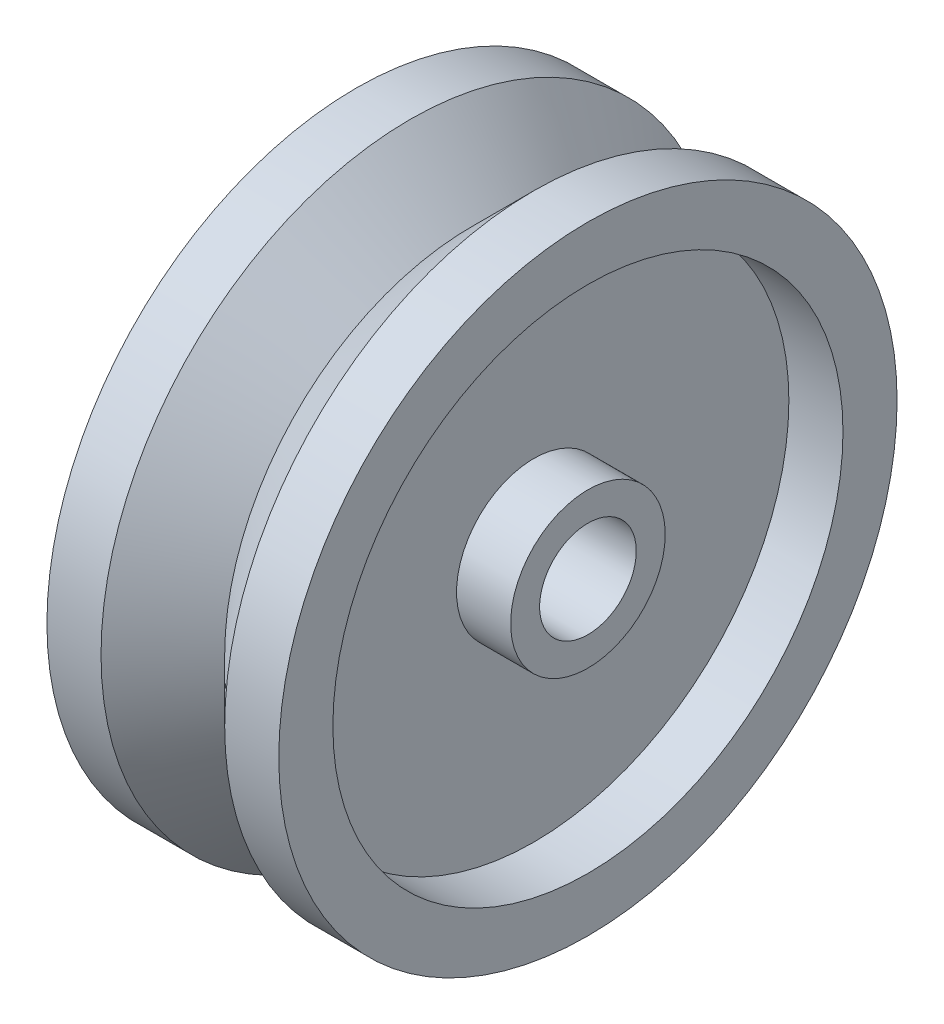
from build123d import *

# Parameters (mm, degrees)
SKETCH2_R           = 20
BOSS_EXTRUDE1_DEPTH = 15
SKETCH3_R           = 16.5
SKETCH3_R_2         = 5
CUT_EXTRUDE1_DEPTH  = 3.5
CUT_EXTRUDE2_START  = -3.5
SKETCH4_R           = 16.5
SKETCH4_R_2         = 5
CUT_EXTRUDE2_DEPTH  = 3.5
SKETCH6_R           = 3.125
CUT_EXTRUDE3_DEPTH  = 33.015621187


with BuildPart() as part:
    # Sketch2 → Boss-Extrude1 (new body)
    with BuildSketch(Plane(origin=(0, 0, 0), x_dir=(0, 0, -1), z_dir=(1, 0, 0))):
        Circle(SKETCH2_R)
    extrude(amount=BOSS_EXTRUDE1_DEPTH)

    # Sketch3 → Cut-Extrude1 (cut)
    with BuildSketch(Plane(origin=(15, 0, 0), x_dir=(0, 0, -1), z_dir=(1, 0, 0))):
        Circle(SKETCH3_R)
        Circle(SKETCH3_R_2, mode=Mode.SUBTRACT)
    extrude(amount=-CUT_EXTRUDE1_DEPTH, mode=Mode.SUBTRACT)

    # Sketch4 → Cut-Extrude2 (cut)
    with BuildSketch(Plane.ZY.offset(CUT_EXTRUDE2_START)):
        with Locations(Location((0, 0, 0), (0, 0, 180))):
            Circle(SKETCH4_R)
        with Locations(Location((0, 0, 0), (0, 0, 180))):
            Circle(SKETCH4_R_2, mode=Mode.SUBTRACT)
    extrude(amount=CUT_EXTRUDE2_DEPTH, mode=Mode.SUBTRACT)

    # Sketch6 → Cut-Extrude3 (cut, through all)
    with BuildSketch(Plane(origin=(15, 0, 0), x_dir=(0, 0, -1), z_dir=(1, 0, 0))):
        Circle(SKETCH6_R)
    extrude(amount=-CUT_EXTRUDE3_DEPTH, mode=Mode.SUBTRACT)

    # Sketch7 → Cut-Revolve3 (revolve, cut)
    with BuildSketch(Plane(origin=(0, 0, 0), x_dir=(1, 0, 0), z_dir=(0, 1, 0)), mode=Mode.PRIVATE) as cut_revolve3_sk:
        Polygon((3.5, 20), (7.5, 16), (11.5, 20), align=None)
    revolve(cut_revolve3_sk.sketch.rotate(Axis((0, 0, 0), (1, 0, 0)), 180), axis=Axis((0, 0, 0), (1, 0, 0)), mode=Mode.SUBTRACT)


solid = part.part
